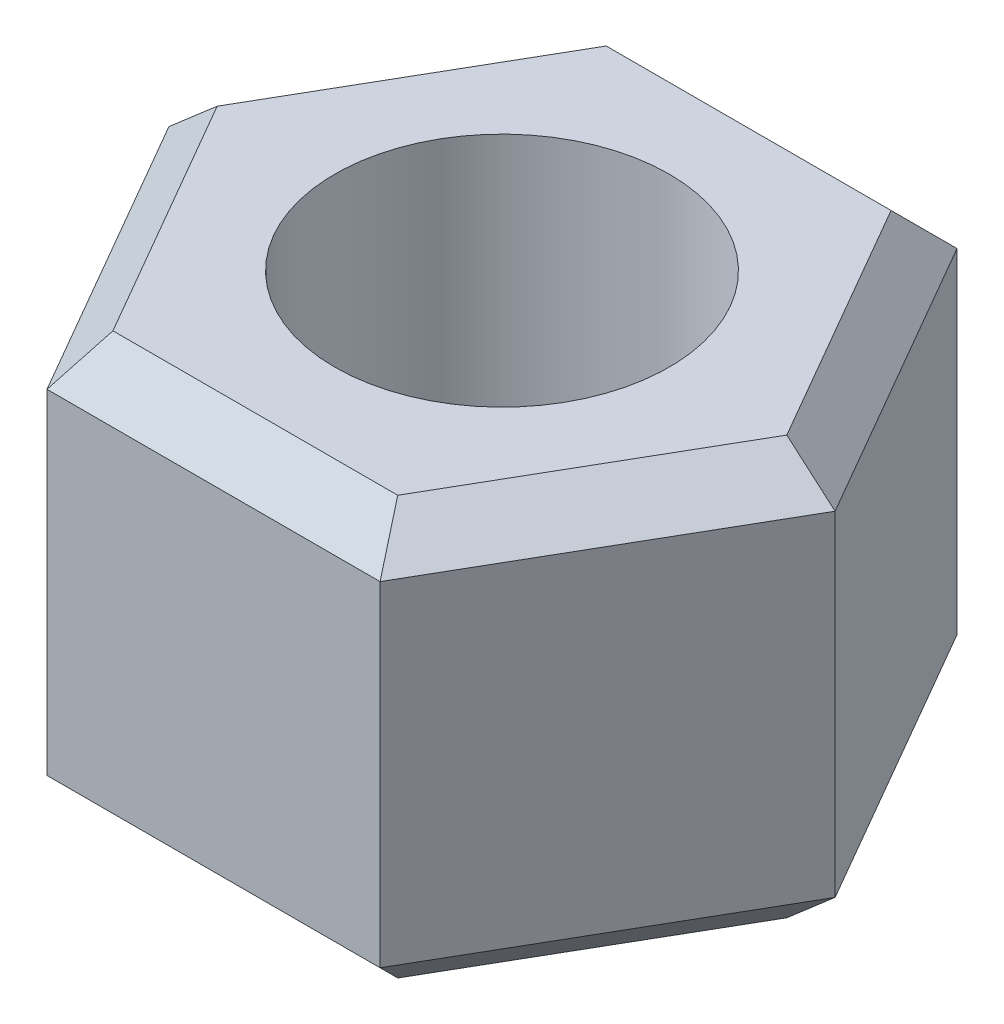
from build123d import *

# Parameters (mm, degrees)
SKETCH_1_R      = 2
EXTRUDE_1_DEPTH = 5
CHAMFER_1_SIZE  = 0.5


with BuildPart() as part:
    # 草图1 → 凸台-拉伸1 (new body)
    with BuildSketch(Plane(origin=(0, 0, 0), x_dir=(1, 0, 0), z_dir=(0, 1, 0))):
        Polygon((-3.983716857, 0), (-1.991858429, -3.45), (1.991858429, -3.45), (3.983716857, 0), (1.991858429, 3.45), (-1.991858429, 3.45), align=None)
        with Locations(Location((0, 0, 0), (0, 0, 270))):
            Circle(SKETCH_1_R, mode=Mode.SUBTRACT)
    extrude(amount=EXTRUDE_1_DEPTH)

    # 倒角1
    chamfer_1_edges = [part.edges().sort_by_distance(p)[0] for p in [
        (0, 5, 3.45),
        (2.987787643, 5, 1.725),
        (2.987787643, 5, -1.725),
        (0, 5, -3.45),
        (-2.987787643, 5, -1.725),
        (0, 0, -3.45),
        (2.987787643, 0, -1.725),
        (2.987787643, 0, 1.725),
        (0, 0, 3.45),
        (-2.987787643, 0, 1.725),
        (-2.987787643, 0, -1.725),
        (-2.987787643, 5, 1.725),
    ]]
    chamfer(chamfer_1_edges, length=CHAMFER_1_SIZE)


solid = part.part
